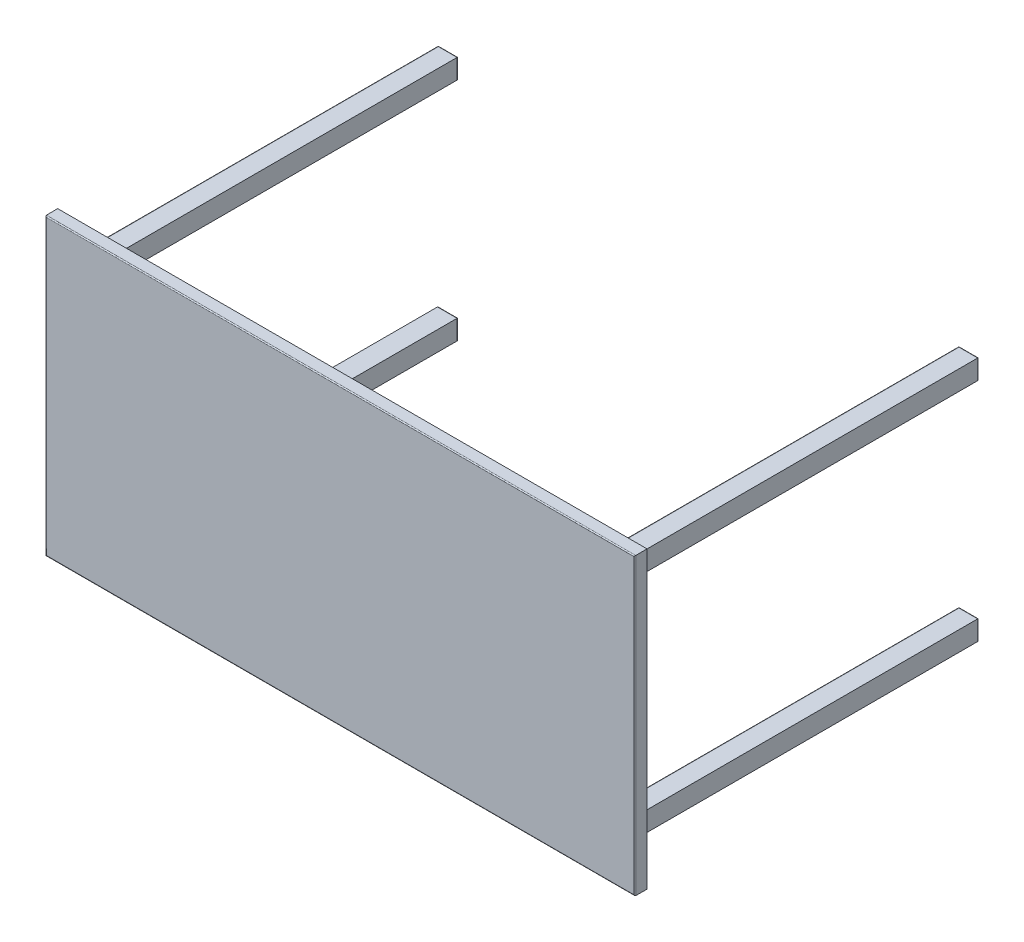
from build123d import *

# Parameters (mm, degrees)
SKETCH1_W           = 1200
SKETCH1_H           = 600
BOSS_EXTRUDE1_DEPTH = 25
SKETCH2_W           = 40
SKETCH2_H           = 40
BOSS_EXTRUDE2_DEPTH = 750
FILLET1_R           = 2


with BuildPart() as part:
    # Sketch1 → Boss-Extrude1 (new body)
    with BuildSketch(Plane.XY):
        Rectangle(SKETCH1_W, SKETCH1_H)
    extrude(amount=BOSS_EXTRUDE1_DEPTH)

    # Sketch2 → Boss-Extrude2 (add)
    with BuildSketch(Plane.XY.offset(25)):
        with Locations((-530, -230)):
            Rectangle(SKETCH2_W, SKETCH2_H)
        with Locations((530, -230)):
            Rectangle(SKETCH2_W, SKETCH2_H)
        with Locations((-530, 230)):
            Rectangle(SKETCH2_W, SKETCH2_H)
        with Locations((530, 230)):
            Rectangle(SKETCH2_W, SKETCH2_H)
    extrude(amount=-BOSS_EXTRUDE2_DEPTH)

    # Fillet1
    fillet1_edges = [part.edges().sort_by_distance(p)[0] for p in [
        (510, 250, -362.5),
        (550, 230, -725),
        (510, 210, -362.5),
        (530, 250, -725),
        (-550, 250, -362.5),
        (-510, 230, -725),
        (-550, 210, -362.5),
        (-530, 250, -725),
        (510, -210, -362.5),
        (550, -230, -725),
        (530, -250, -725),
        (530, -210, -725),
        (-550, -230, -725),
        (-510, -230, -725),
        (-550, -250, -362.5),
        (-530, -210, -725),
        (-600, 0, 25),
        (600, 0, 25),
        (0, -300, 25),
        (0, 300, 25),
    ]]
    fillet(fillet1_edges, radius=FILLET1_R)


solid = part.part
